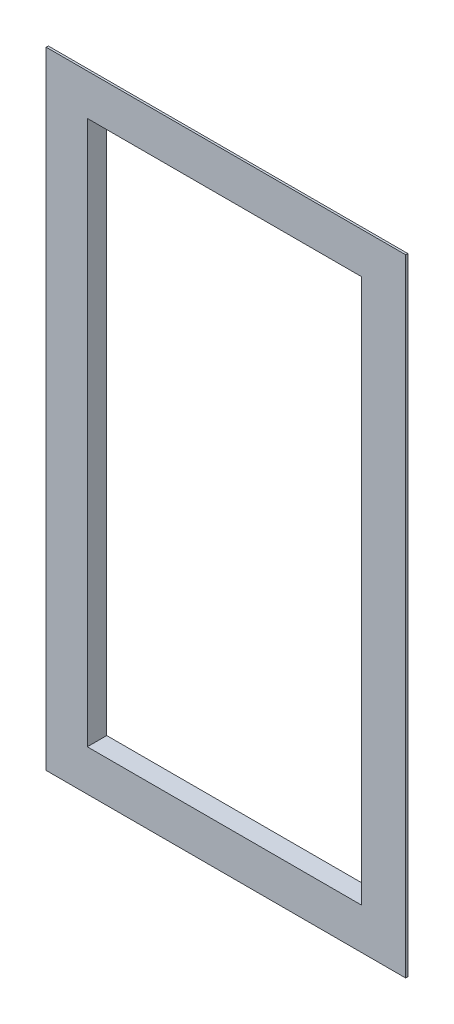
from build123d import *

# Parameters (mm, degrees)
BOSS_EXTRUDE1_DEPTH = 3.5
CHAMFER1_SIZE       = 7
CHAMFER1_SIZE2      = 3.116600797


with BuildPart() as part:
    # Sketch1 → Boss-Extrude1 (new body)
    with BuildSketch(Plane.XY):
        Polygon((7.962573201, 32.016439516), (15.870478339, 24.620213101), (-48.846502793, 24.620213101), (-41.450276378, 32.016439516), align=None)
        Polygon((-48.846502793, 137.412665932), (-41.450276378, 130.016439516), (-41.450276378, 32.016439516), (-48.846502793, 24.620213101), align=None)
        Polygon((15.870478339, 137.412665932), (-48.846502793, 137.412665932), (-41.450276378, 130.016439516), (7.962573201, 130.016439516), align=None)
        Polygon((15.870478339, 137.412665932), (15.870478339, 24.620213101), (7.962573201, 32.016439516), (7.962573201, 130.016439516), align=None)
    extrude(amount=BOSS_EXTRUDE1_DEPTH)

    # Chamfer1
    chamfer1_edges = [part.edges().sort_by_distance(p)[0] for p in [
        (-48.846502793, 81.016439516, 0),
        (-16.488012227, 137.412665932, 0),
        (15.870478339, 81.016439516, 0),
        (-16.488012227, 24.620213101, 0),
    ]]
    chamfer1_side = [part.faces().sort_by_distance(p)[0] for p in [
        (-16.488012227, 25.920614003, 0),
    ]]
    chamfer(chamfer1_edges, length=CHAMFER1_SIZE, length2=CHAMFER1_SIZE2, reference=chamfer1_side[0])


solid = part.part
